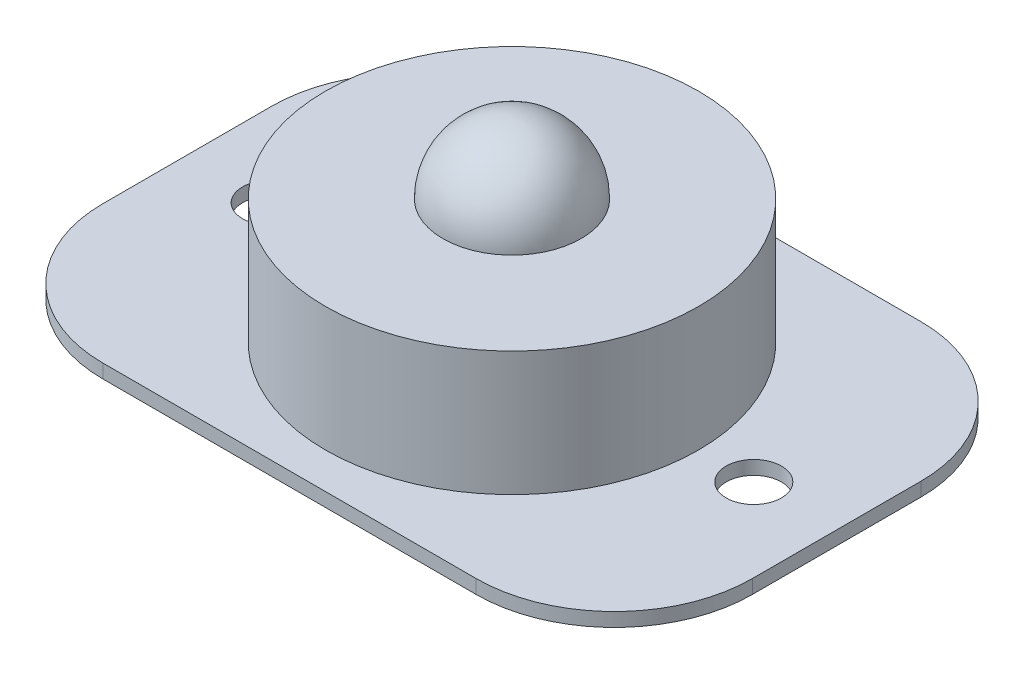
from build123d import *

# Parameters (mm, degrees)
SKETCH_1_R      = 16.1
EXTRUDE_1_DEPTH = 1
SKETCH_2_R      = 13.5
EXTRUDE_2_DEPTH = 9
HOLE_WIZARD_1_D = 4
FILLET_1_R      = 10


with BuildPart() as part:
    # 草图1 → 凸台-拉伸1 (new body)
    with BuildSketch(Plane(origin=(0, 0, 0), x_dir=(1, 0, 0), z_dir=(0, 1, 0))):
        with BuildLine():
            Line((-23.5, 16.1), (-23.5, -16.1))
            Line((-23.5, -16.1), (0, -16.1))
            ThreePointArc((0, -16.1), (-16.1, 0), (0, 16.1))
            Line((0, 16.1), (-23.5, 16.1))
        make_face()
        Circle(SKETCH_1_R)
        with BuildLine():
            ThreePointArc((16.1, 0), (11.384419177, -11.384419177), (0, -16.1))
            Line((0, -16.1), (23.5, -16.1))
            Line((23.5, -16.1), (23.5, 16.1))
            Line((23.5, 16.1), (0, 16.1))
            ThreePointArc((0, 16.1), (11.384419177, 11.384419177), (16.1, 0))
        make_face()
    extrude(amount=EXTRUDE_1_DEPTH)

    # 草图2 → 凸台-拉伸2 (add)
    with BuildSketch(Plane(origin=(0, 1, 0), x_dir=(1, 0, 0), z_dir=(0, 1, 0))):
        with Locations(Location((0, 0, 0), (0, 0, 270))):
            Circle(SKETCH_2_R)
    extrude(amount=EXTRUDE_2_DEPTH)

    # 草图3 → 旋转1 (revolve)
    with BuildSketch(Plane.ZY):
        with BuildLine():
            Line((0, 15), (0, 10))
            Line((0, 10), (5, 10))
            ThreePointArc((5, 10), (3.535533906, 13.535533906), (0, 15))
        make_face()
    revolve(axis=Axis((0, 15, 0), (0, -1, 0)))

    # 孔1 (through all)
    with Locations(Plane(origin=(0, 1, 0), x_dir=(1, 0, 0), z_dir=(0, 1, 0))):
        with Locations((-17.5, 0), (17.5, 0)):
            Hole(HOLE_WIZARD_1_D / 2)

    # 圆角1
    fillet_1_edges = [part.edges().sort_by_distance(p)[0] for p in [
        (-23.5, 0.5, 16.1),
        (-23.5, 0.5, -16.1),
        (23.5, 0.5, -16.1),
        (23.5, 0.5, 16.1),
    ]]
    fillet(fillet_1_edges, radius=FILLET_1_R)


solid = part.part
